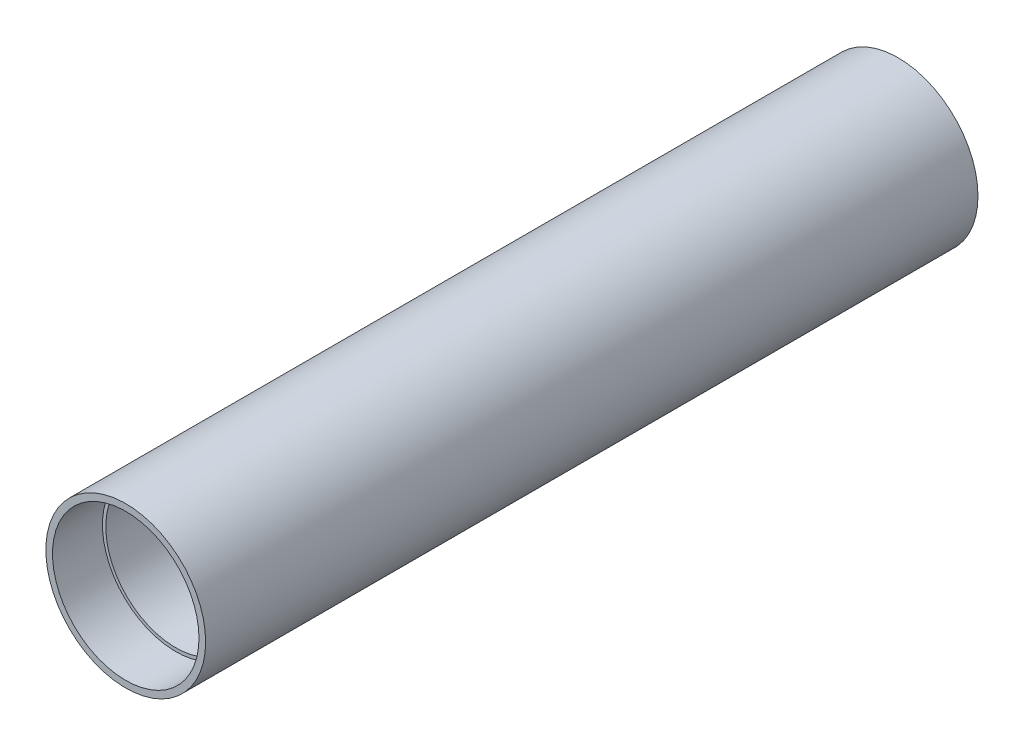
from build123d import *


with BuildPart() as part:
    # Эскиз1 → Повернуть1 (revolve)
    with BuildSketch(Plane(origin=(0, 0, 0), x_dir=(0, 0, -1), z_dir=(1, 0, 0)), mode=Mode.PRIVATE) as revolve_1_sk:
        Polygon((0, 24), (-116, 24), (-116, 22), (-101, 22), (-101, 21), (0, 21), align=None)
    revolve_1 = revolve(revolve_1_sk.sketch.rotate(Axis((0, 0, 1000), (0, 0, -1)), 90), axis=Axis((0, 0, 1000), (0, 0, -1)))

    # Зеркальное отражение1: Повернуть1 across plane
    add(revolve_1.mirror(Plane(origin=(0, 24, 0), x_dir=(1, 0, 0), z_dir=(0, 0, 1))))


solid = part.part
